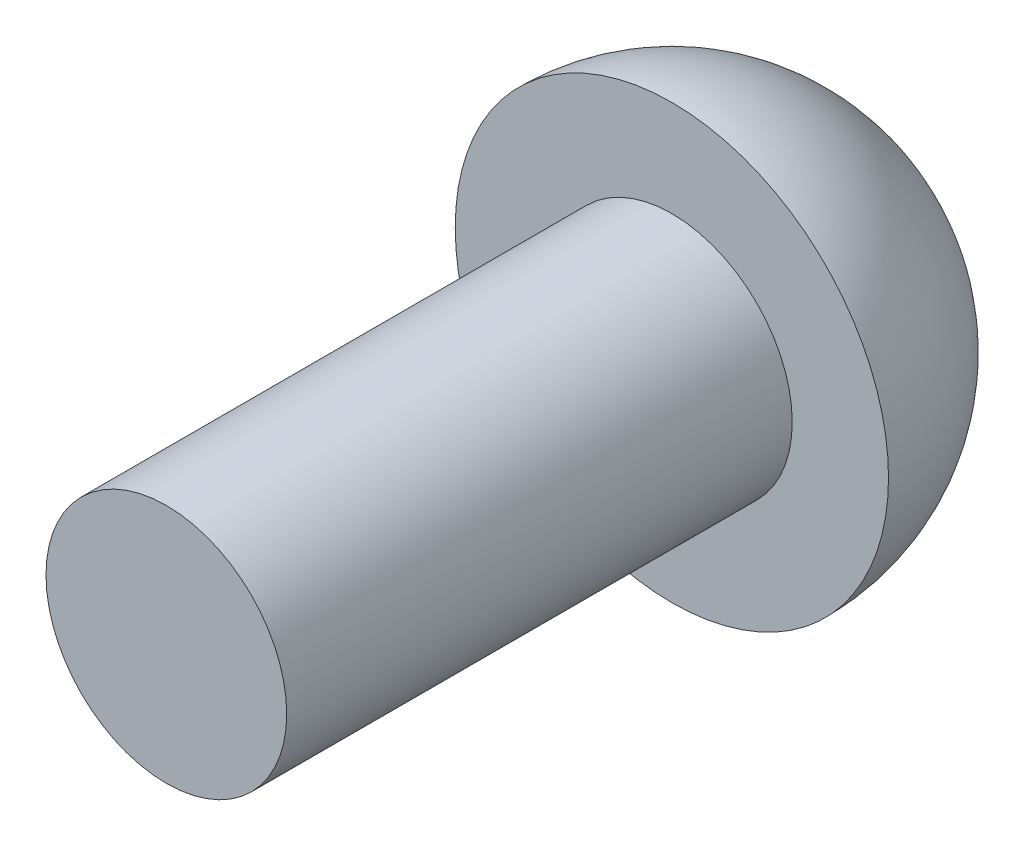
from build123d import *

# Parameters (mm, degrees)
REVOLVE1_ANGLE      = 180
SKETCH2_R           = 5
BOSS_EXTRUDE1_DEPTH = 21


with BuildPart() as part:
    # Sketch1 → Revolve1 (revolve)
    with BuildSketch(Plane.XY):
        with BuildLine():
            Line((0, 9), (0, -9))
            ThreePointArc((0, -9), (-9, 0), (0, 9))
        make_face()
    revolve(axis=Axis((0, 9, 0), (0, -1, 0)), revolution_arc=REVOLVE1_ANGLE)

    # Sketch2 → Boss-Extrude1 (add)
    with BuildSketch(Plane.XY):
        with Locations(Location((0, 0, 0), (0, 0, 180))):
            Circle(SKETCH2_R)
    extrude(amount=BOSS_EXTRUDE1_DEPTH)


solid = part.part
